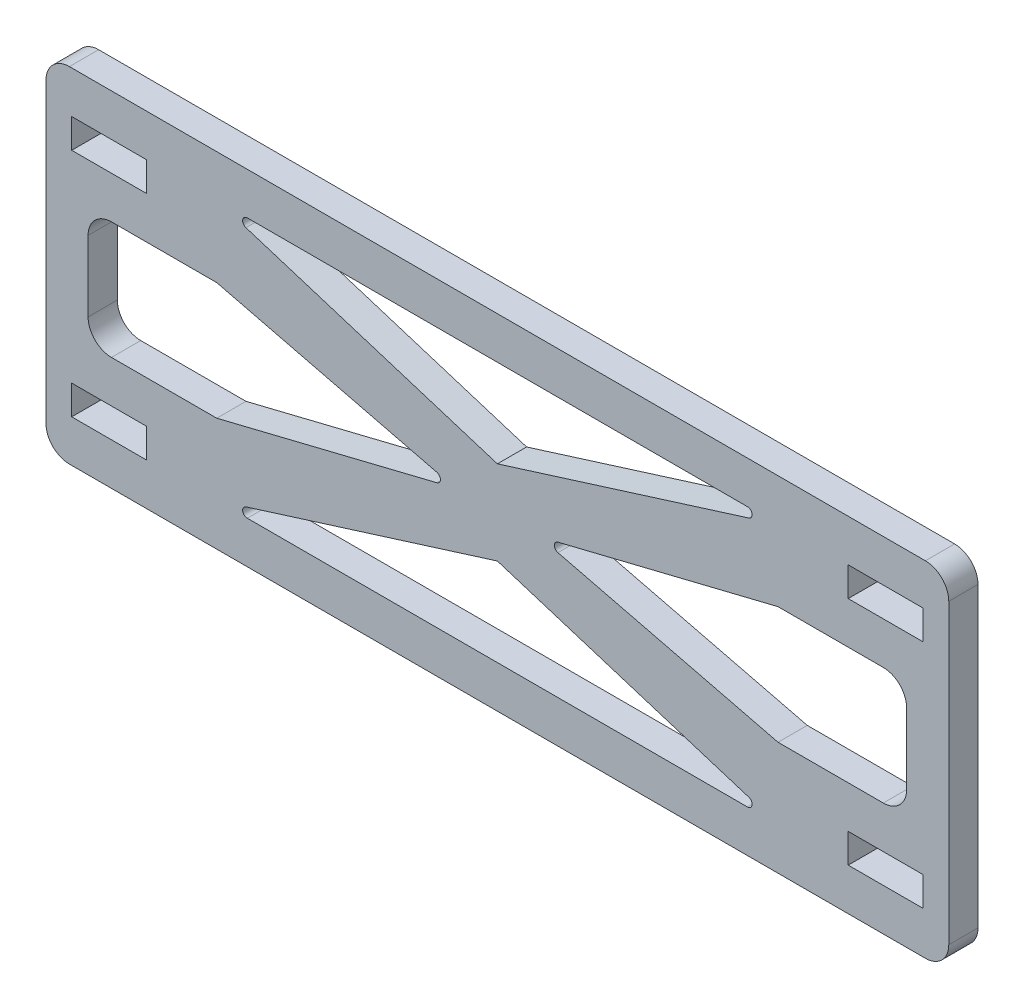
from build123d import *

# Parameters (mm, degrees)
SKETCH1_W           = 49.022
SKETCH1_H           = 18.6944
SKETCH1_W_2         = 38.1
SKETCH1_H_2         = 1.5875
BOSS_EXTRUDE1_DEPTH = 1.5875
CUT_EXTRUDE1_REACH  = 53.735
FILLET1_R           = 0.254
FILLET2_R           = 1.27


with BuildPart() as part:
    # Sketch1 → Boss-Extrude1 (new body)
    # profile 1 of 2: a face of its own
    with BuildSketch(Plane.XY.offset(56.947143149)):
        with Locations((11.232994638, 28.020399012)):
            Rectangle(SKETCH1_W, SKETCH1_H)
        Polygon((-11.881005362, 20.959199012), (-11.881005362, 22.546699012), (-10.992005362, 22.546699012), (-8.706005362, 22.546699012), (-7.817005362, 22.546699012), (-7.817005362, 20.959199012), (-8.706005362, 20.959199012), (-10.992005362, 20.959199012), align=None, mode=Mode.SUBTRACT)
        Polygon((33.457994638, 22.546699012), (34.346994638, 22.546699012), (34.346994638, 20.959199012), (33.457994638, 20.959199012), (31.171994638, 20.959199012), (30.282994638, 20.959199012), (30.282994638, 22.546699012), (31.171994638, 22.546699012), align=None, mode=Mode.SUBTRACT)
        Polygon((31.171994638, 33.494099012), (30.282994638, 33.494099012), (-7.817005362, 33.494099012), (-8.706005362, 33.494099012), (-10.992005362, 33.494099012), (-11.881005362, 33.494099012), (-11.881005362, 35.081599012), (-10.992005362, 35.081599012), (-8.706005362, 35.081599012), (-7.817005362, 35.081599012), (30.282994638, 35.081599012), (31.171994638, 35.081599012), (33.457994638, 35.081599012), (34.346994638, 35.081599012), (34.346994638, 33.494099012), (33.457994638, 33.494099012), align=None, mode=Mode.SUBTRACT)
    # profile 2 of 2: a face of its own
    with BuildSketch(Plane.XY.offset(56.947143149)):
        with Locations((11.232994638, 34.287849012)):
            Rectangle(SKETCH1_W_2, SKETCH1_H_2)
    extrude(amount=BOSS_EXTRUDE1_DEPTH)

    # Sketch3 → Cut-Extrude1 (cut, up to next)
    with BuildSketch(Plane.XY.offset(58.534643149), mode=Mode.PRIVATE) as cut_extrude1_sk1:
        Polygon((11.232994638, 25.734399012), (-4.006890486, 20.959199012), (26.472879762, 20.959199012), align=None)
    cut_extrude1_tool1 = extrude(cut_extrude1_sk1.sketch, amount=-CUT_EXTRUDE1_REACH, mode=Mode.PRIVATE) & part.part
    # Sketch3 → Cut-Extrude1 (cut, up to next)
    with BuildSketch(Plane.XY.offset(58.534643149), mode=Mode.PRIVATE) as cut_extrude1_sk2:
        Polygon((13.518994638, 28.020399012), (26.472879762, 31.208099012), (33.457994638, 31.208099012), (33.457994638, 24.832699012), (26.472879762, 24.832699012), align=None)
    cut_extrude1_tool2 = extrude(cut_extrude1_sk2.sketch, amount=-CUT_EXTRUDE1_REACH, mode=Mode.PRIVATE) & part.part
    # Sketch3 → Cut-Extrude1 (cut, up to next)
    with BuildSketch(Plane.XY.offset(58.534643149), mode=Mode.PRIVATE) as cut_extrude1_sk3:
        Polygon((11.232994638, 30.306399012), (-4.006890486, 35.081599012), (26.472879762, 35.081599012), align=None)
    cut_extrude1_tool3 = extrude(cut_extrude1_sk3.sketch, amount=-CUT_EXTRUDE1_REACH, mode=Mode.PRIVATE) & part.part
    # Sketch3 → Cut-Extrude1 (cut, up to next)
    with BuildSketch(Plane.XY.offset(58.534643149), mode=Mode.PRIVATE) as cut_extrude1_sk4:
        Polygon((-4.006890486, 31.208099012), (-10.992005362, 31.208099012), (-10.992005362, 24.832699012), (-4.006890486, 24.832699012), (8.946994638, 28.020399012), align=None)
    cut_extrude1_tool4 = extrude(cut_extrude1_sk4.sketch, amount=-CUT_EXTRUDE1_REACH, mode=Mode.PRIVATE) & part.part
    add(cut_extrude1_tool1.solids().sort_by_distance((11.232995, 22.550932, 58.534643))[0], mode=Mode.SUBTRACT)
    add(cut_extrude1_tool2.solids().sort_by_distance((26.207595, 28.020399, 58.534643))[0], mode=Mode.SUBTRACT)
    add(cut_extrude1_tool3.solids().sort_by_distance((11.232995, 33.489866, 58.534643))[0], mode=Mode.SUBTRACT)
    add(cut_extrude1_tool4.solids().sort_by_distance((-3.741606, 28.020399, 58.534643))[0], mode=Mode.SUBTRACT)

    # Fillet1
    fillet1_edges = [part.edges().sort_by_distance(p)[0] for p in [
        (-4.006890486, 35.081599012, 57.740893149),
        (26.472879762, 35.081599012, 57.740893149),
        (8.946994638, 28.020399012, 57.740893149),
        (-4.006890486, 20.959199012, 57.740893149),
        (26.472879762, 20.959199012, 57.740893149),
        (13.518994638, 28.020399012, 57.740893149),
    ]]
    fillet(fillet1_edges, radius=FILLET1_R)

    # Fillet2
    fillet2_edges = [part.edges().sort_by_distance(p)[0] for p in [
        (-10.992005362, 31.208099012, 57.740893149),
        (-10.992005362, 24.832699012, 57.740893149),
        (-13.278005362, 37.367599012, 57.740893149),
        (35.743994638, 37.367599012, 57.740893149),
        (35.743994638, 18.673199012, 57.740893149),
        (-13.278005362, 18.673199012, 57.740893149),
        (33.457994638, 31.208099012, 57.740893149),
        (33.457994638, 24.832699012, 57.740893149),
    ]]
    fillet(fillet2_edges, radius=FILLET2_R)


solid = part.part
